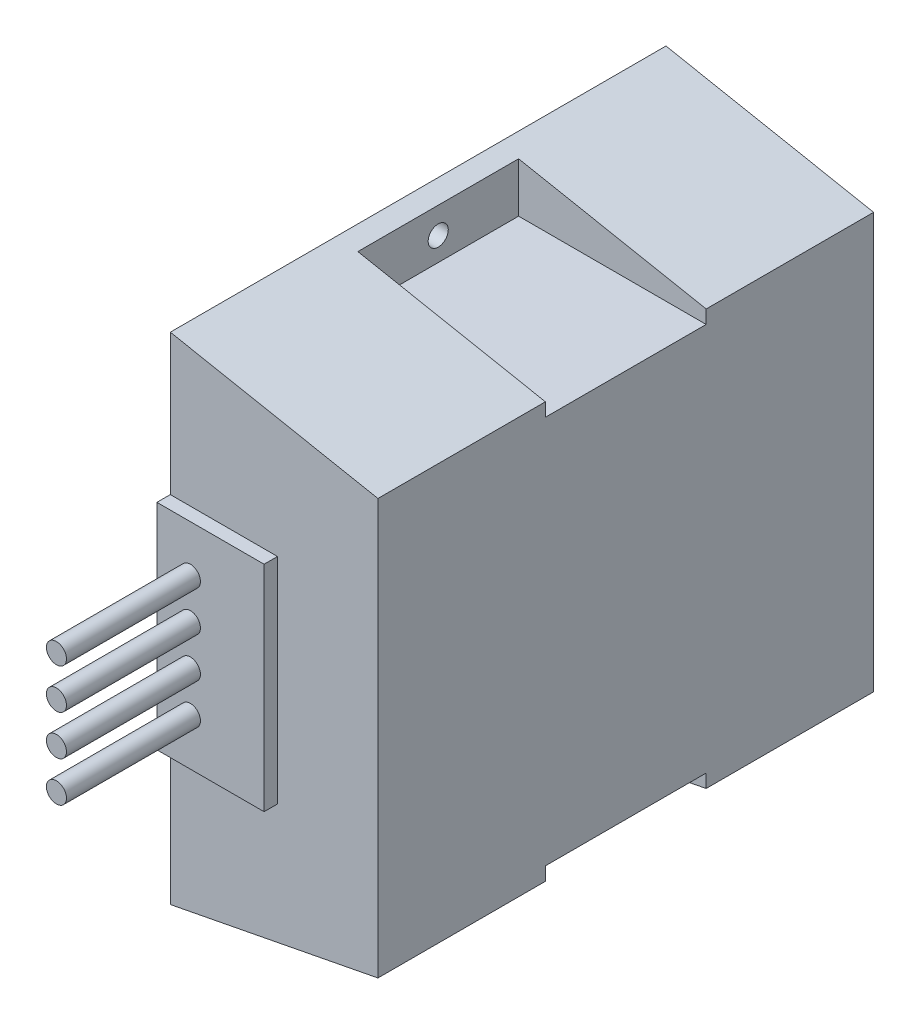
from build123d import *

# Parameters (mm, degrees)
SKETCH_3_W          = 24
SKETCH_3_H          = 8
CUT_EXTRUDE_1_DEPTH = 28
SKETCH_4_W          = 16
SKETCH_4_H          = 32
EXTRUDE_1_DEPTH     = 2
SKETCH_5_R          = 1.5
EXTRUDE_2_DEPTH     = 20
SKETCH_6_R          = 1.5
CUT_EXTRUDE_2_DEPTH = 77.229915477


with BuildPart() as part:
    # 草图2 → 放样1 section 0
    with BuildSketch(Plane(origin=(31, 0, 0), x_dir=(0, 0, -1), z_dir=(1, 0, 0))):
        with BuildLine():
            Line((-37, 31), (37, 31))
            Line((37, 31), (37, -31))
            Line((37, -31), (-37, -31))
            Line((-37, -31), (-37, 31))
        make_face()
    # 草图1 → 放样1 section 1
    with BuildSketch(Plane(origin=(0, 0, 0), x_dir=(0, 0, -1), z_dir=(1, 0, 0))):
        with BuildLine():
            Line((-37, 37), (37, 37))
            Line((37, 37), (37, -37))
            Line((37, -37), (-37, -37))
            Line((-37, -37), (-37, 37))
        make_face()
    loft()

    # 草图3 → 切除-拉伸1 (cut)
    with BuildSketch(Plane(origin=(31, 0, 0), x_dir=(0, 0, -1), z_dir=(1, 0, 0))):
        with Locations((0, 33)):
            Rectangle(SKETCH_3_W, SKETCH_3_H)
    cut_extrude_1 = extrude(amount=-CUT_EXTRUDE_1_DEPTH, mode=Mode.SUBTRACT)

    # 镜向1: 切除-拉伸1 across plane
    add(cut_extrude_1.mirror(Plane.ZX), mode=Mode.SUBTRACT)

    # 草图4 → 凸台-拉伸1 (add)
    with BuildSketch(Plane.XY.offset(37)):
        with Locations((8, 0)):
            Rectangle(SKETCH_4_W, SKETCH_4_H)
    extrude(amount=EXTRUDE_1_DEPTH)

    # 草图5 → 凸台-拉伸2 (add)
    with BuildSketch(Plane.XY.offset(39)):
        with Locations(Location((5, -3, 0), (0, 0, 180))):
            Circle(SKETCH_5_R)
        with Locations(Location((5, -9, 0), (0, 0, 180))):
            Circle(SKETCH_5_R)
    extrude_2 = extrude(amount=EXTRUDE_2_DEPTH)

    # 镜向2: 凸台-拉伸2 across plane
    add(extrude_2.mirror(Plane.ZX))

    # 草图6 → 切除-拉伸2 (cut, through all)
    with BuildSketch(Plane.ZY):
        with Locations((0, -32.5)):
            Circle(SKETCH_6_R)
    cut_extrude_2 = extrude(amount=-CUT_EXTRUDE_2_DEPTH, mode=Mode.SUBTRACT)

    # 镜向3: 切除-拉伸2 across plane
    add(cut_extrude_2.mirror(Plane.ZX), mode=Mode.SUBTRACT)


solid = part.part
